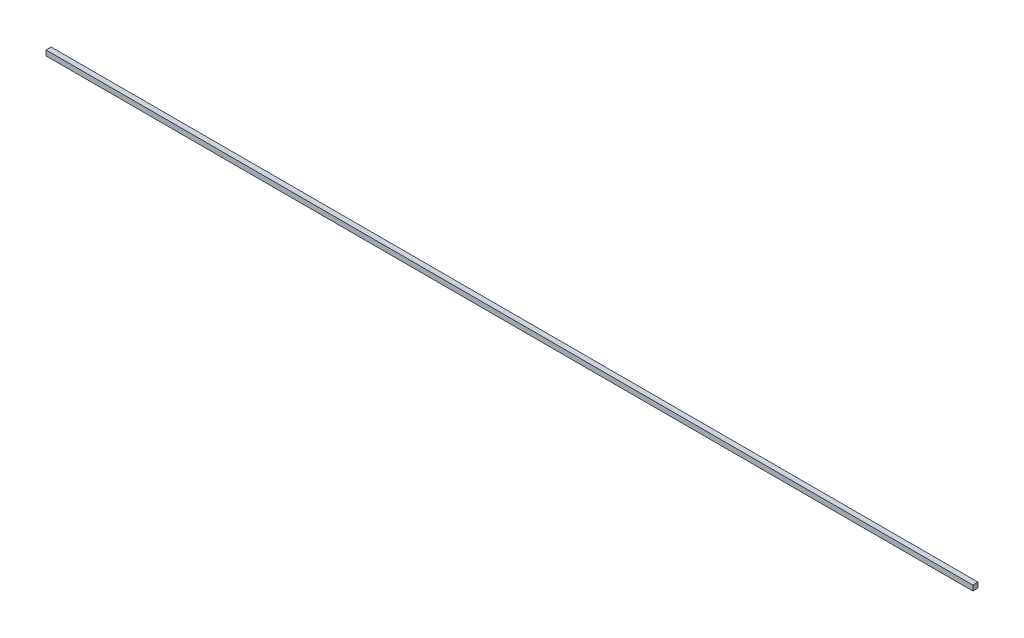
from build123d import *

# Parameters (mm, degrees)
SKETCH1_W           = 5
SKETCH1_H           = 5
BOSS_EXTRUDE1_DEPTH = 900


with BuildPart() as part:
    # Sketch1 → Boss-Extrude1 (new body)
    with BuildSketch(Plane(origin=(0, 0, 0), x_dir=(0, 0, -1), z_dir=(1, 0, 0))):
        Rectangle(SKETCH1_W, SKETCH1_H)
    extrude(amount=BOSS_EXTRUDE1_DEPTH)


solid = part.part
